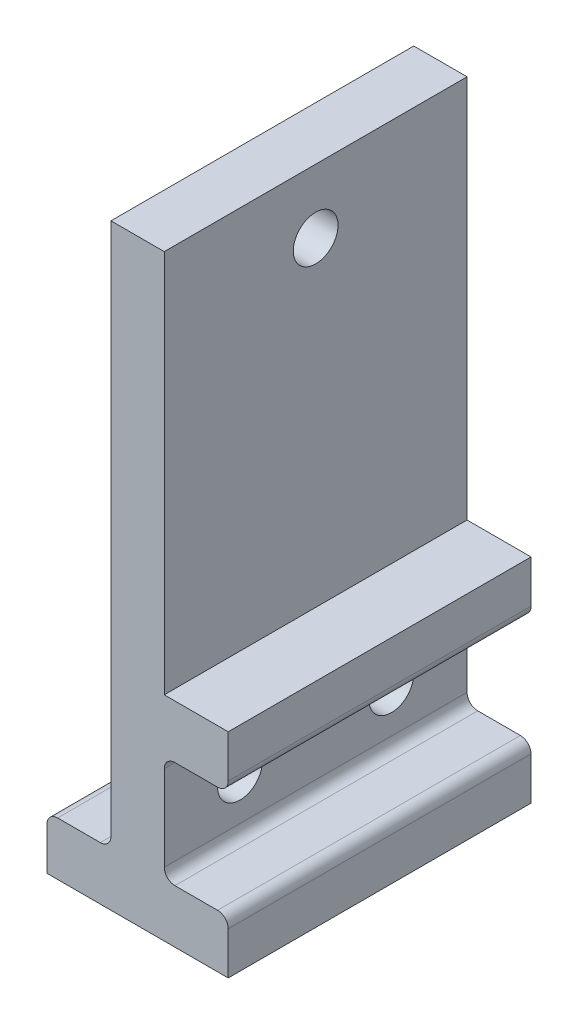
from build123d import *

# Parameters (mm, degrees)
BOSS_EXTRUDE1_DEPTH = 56.8
CUT_EXTRUDE1_REACH  = 129.492
SKETCH2_R           = 4.2
CUT_EXTRUDE3_REACH  = 129.492
SKETCH4_R           = 4.2
FILLET1_R           = 2


with BuildPart() as part:
    # Sketch1 → Boss-Extrude1 (new body)
    with BuildSketch(Plane.XY):
        Polygon((0, 0), (0, 10), (12, 10), (12, 112), (22, 112), (22, 40), (34, 40), (34, 30), (22, 30), (22, 10), (34, 10), (34, 0), align=None)
    extrude(amount=BOSS_EXTRUDE1_DEPTH)

    # Sketch2 → Cut-Extrude1 (cut, up to next)
    with BuildSketch(Plane.ZY.offset(-12), mode=Mode.PRIVATE) as cut_extrude1_sk1:
        with Locations(Location((14.2, 20, 0), (0, 0, 270))):
            Circle(SKETCH2_R)
    cut_extrude1_tool1 = extrude(cut_extrude1_sk1.sketch, amount=-CUT_EXTRUDE1_REACH, mode=Mode.PRIVATE) & part.part
    # Sketch2 → Cut-Extrude1 (cut, up to next)
    with BuildSketch(Plane.ZY.offset(-12), mode=Mode.PRIVATE) as cut_extrude1_sk2:
        with Locations(Location((42.6, 20, 0), (0, 0, 270))):
            Circle(SKETCH2_R)
    cut_extrude1_tool2 = extrude(cut_extrude1_sk2.sketch, amount=-CUT_EXTRUDE1_REACH, mode=Mode.PRIVATE) & part.part
    add(cut_extrude1_tool1.solids().sort_by_distance((12, 20, 14.2))[0], mode=Mode.SUBTRACT)
    add(cut_extrude1_tool2.solids().sort_by_distance((12, 20, 42.6))[0], mode=Mode.SUBTRACT)

    # Sketch4 → Cut-Extrude3 (cut, up to next)
    with BuildSketch(Plane.ZY.offset(-12), mode=Mode.PRIVATE) as cut_extrude3_sk1:
        with Locations(Location((28.4, 100, 0), (0, 0, 270))):
            Circle(SKETCH4_R)
    cut_extrude3_tool1 = extrude(cut_extrude3_sk1.sketch, amount=-CUT_EXTRUDE3_REACH, mode=Mode.PRIVATE) & part.part
    add(cut_extrude3_tool1.solids().sort_by_distance((12, 100, 28.4))[0], mode=Mode.SUBTRACT)

    # Fillet1
    fillet1_edges = [part.edges().sort_by_distance(p)[0] for p in [
        (0, 10, 28.4),
        (12, 10, 28.4),
        (34, 30, 28.4),
        (22, 30, 28.4),
        (22, 10, 28.4),
        (34, 10, 28.4),
    ]]
    fillet(fillet1_edges, radius=FILLET1_R)


solid = part.part
